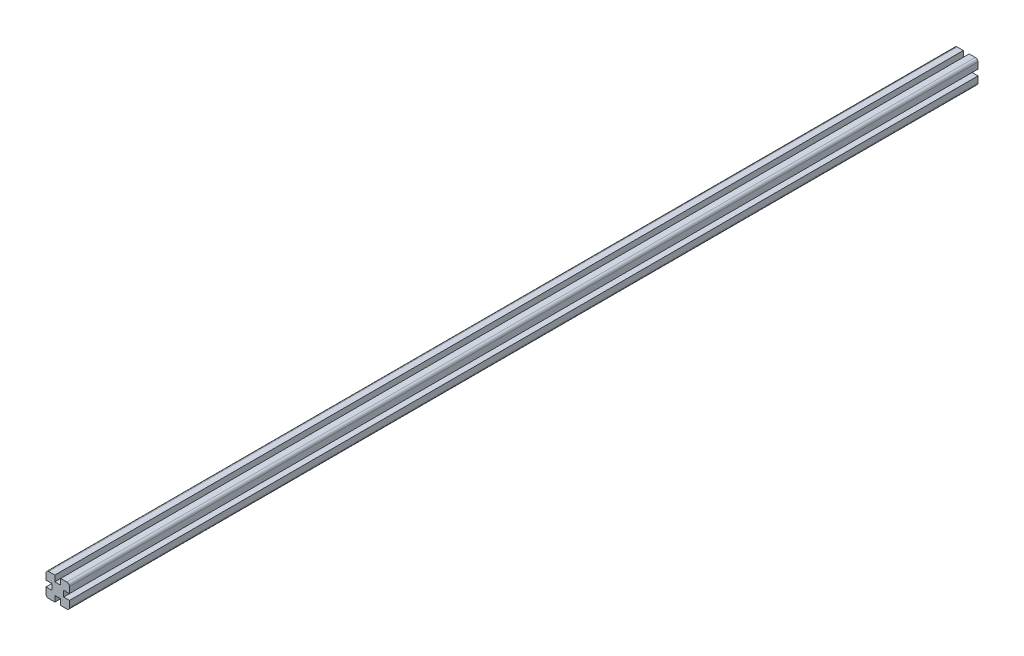
from build123d import *

# Parameters (mm, degrees)
BOSS_EXTRUDE1_DEPTH = 1550


with BuildPart() as part:
    # Sketch1 → Boss-Extrude1 (new body)
    with BuildSketch(Plane.XY):
        with BuildLine():
            Line((-15.5, -20), (-5, -20))
            Line((-5, -20), (-5, -10))
            Line((-5, -10), (5, -10))
            Line((5, -10), (5, -20))
            Line((5, -20), (15.5, -20))
            ThreePointArc((15.5, -20), (18.681980515, -18.681980515), (20, -15.5))
            Line((20, -15.5), (20, -5))
            Line((20, -5), (10, -5))
            Line((10, -5), (10, 5))
            Line((10, 5), (20, 5))
            Line((20, 5), (20, 15.5))
            ThreePointArc((20, 15.5), (18.681980515, 18.681980515), (15.5, 20))
            Line((15.5, 20), (5, 20))
            Line((5, 20), (5, 10))
            Line((5, 10), (-5, 10))
            Line((-5, 10), (-5, 20))
            Line((-5, 20), (-8, 20))
            Line((-8, 20), (-15, 20))
            Line((-15, 20), (-15.5, 20))
            ThreePointArc((-15.5, 20), (-18.681980515, 18.681980515), (-20, 15.5))
            Line((-20, 15.5), (-20, 5))
            Line((-20, 5), (-10, 5))
            Line((-10, 5), (-10, -5))
            Line((-10, -5), (-20, -5))
            Line((-20, -5), (-20, -15.5))
            ThreePointArc((-20, -15.5), (-18.681980515, -18.681980515), (-15.5, -20))
        make_face()
    extrude(amount=BOSS_EXTRUDE1_DEPTH)


solid = part.part
